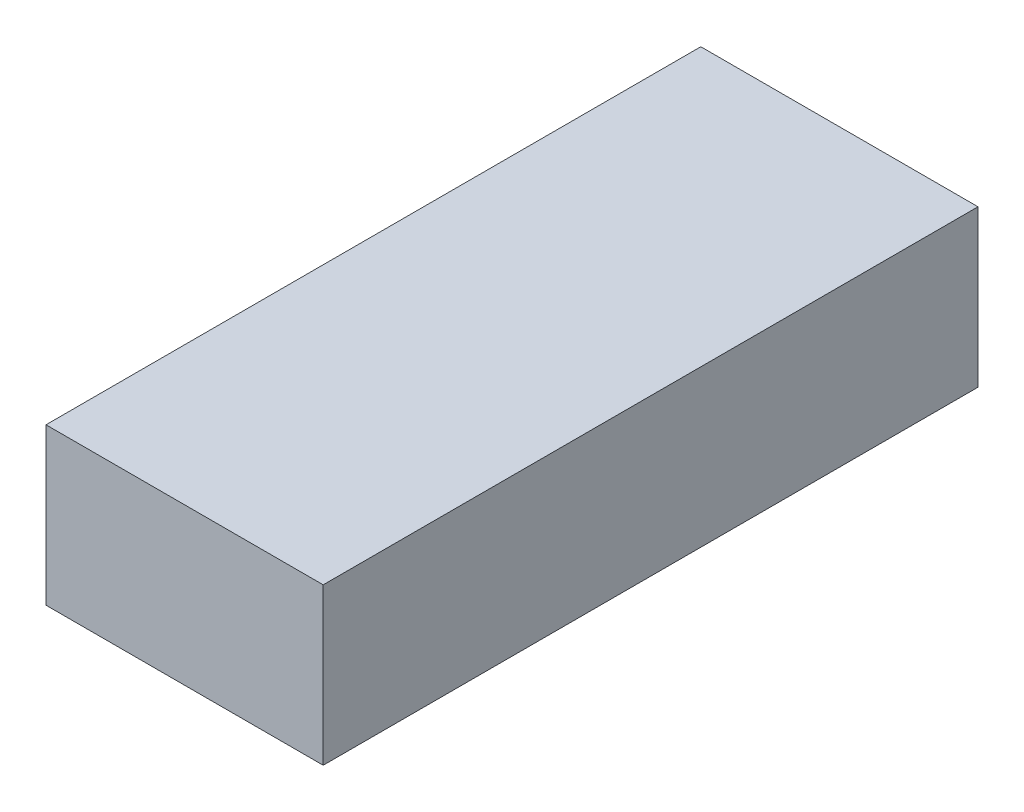
from build123d import *

# Parameters (mm, degrees)
ESBO_O1_W                = 6.35
ESBO_O1_H                = 3.58
RESSALTO_EXTRUS_O1_DEPTH = 15


with BuildPart() as part:
    # Esboço1 → Ressalto-extrusão1 (new body)
    with BuildSketch(Plane.XY):
        Rectangle(ESBO_O1_W, ESBO_O1_H)
    extrude(amount=RESSALTO_EXTRUS_O1_DEPTH)


solid = part.part
